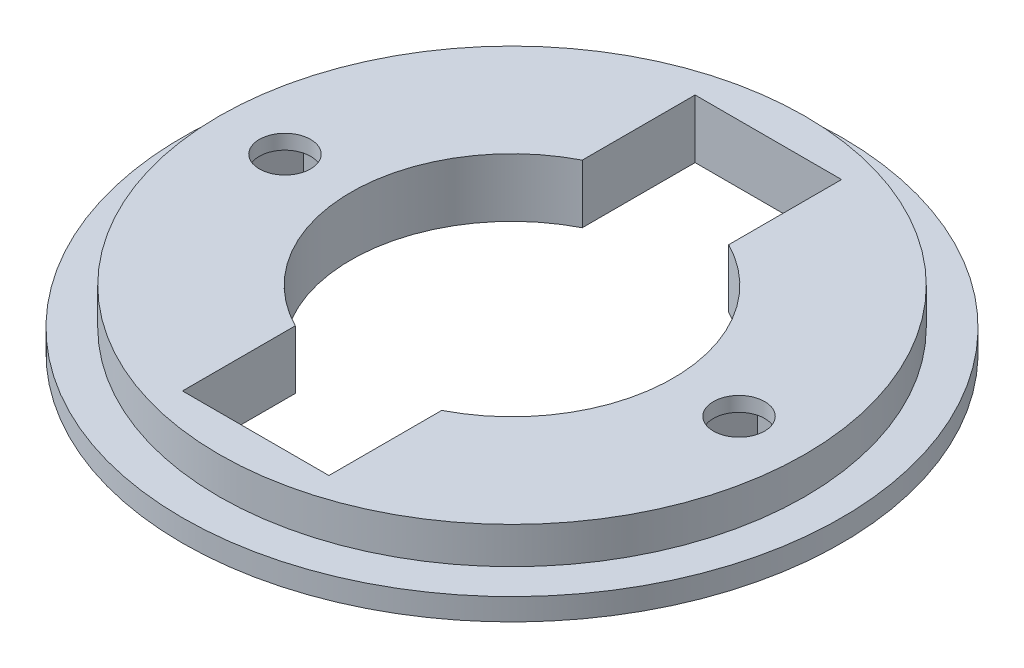
from build123d import *

# Parameters (mm, degrees)
SKETCH1_R           = 22.5
BOSS_EXTRUDE2_DEPTH = 4
CUT_EXTRUDE1_START  = -2.5
SKETCH2_R           = 22.5
SKETCH2_R_2         = 20
CUT_EXTRUDE1_DEPTH  = 2.5
CUT_EXTRUDE2_DEPTH  = 33.070235422
SKETCH4_R           = 1.75
CUT_EXTRUDE3_DEPTH  = 33.070235422
CUT_EXTRUDE4_DEPTH  = 3


with BuildPart() as part:
    # Sketch1 → Boss-Extrude2 (new body)
    with BuildSketch(Plane(origin=(0, 0, 0), x_dir=(1, 0, 0), z_dir=(0, 1, 0))):
        with Locations(Location((0, 0, 0), (0, 0, 270))):
            Circle(SKETCH1_R)
    extrude(amount=BOSS_EXTRUDE2_DEPTH)

    # Sketch2 → Cut-Extrude1 (cut)
    with BuildSketch(Plane(origin=(0, 4, 0), x_dir=(1, 0, 0), z_dir=(0, 1, 0)).offset(CUT_EXTRUDE1_START)):
        with Locations(Location((0, 0, 0), (0, 0, 270))):
            Circle(SKETCH2_R)
        with Locations(Location((0, 0, 0), (0, 0, 270))):
            Circle(SKETCH2_R_2, mode=Mode.SUBTRACT)
    extrude(amount=CUT_EXTRUDE1_DEPTH, mode=Mode.SUBTRACT)

    # Sketch3 → Cut-Extrude2 (cut, through all)
    with BuildSketch(Plane(origin=(0, 4, 0), x_dir=(1, 0, 0), z_dir=(0, 1, 0))):
        with BuildLine():
            Line((5, -9.797958971), (5, -17.5))
            Line((5, -17.5), (-5, -17.5))
            Line((-5, -17.5), (-5, -9.797958971))
            ThreePointArc((-5, -9.797958971), (-11, 0), (-5, 9.797958971))
            Line((-5, 9.797958971), (-5, 17.5))
            Line((-5, 17.5), (5, 17.5))
            Line((5, 17.5), (5, 9.797958971))
            ThreePointArc((5, 9.797958971), (11, 0), (5, -9.797958971))
        make_face()
    extrude(amount=-CUT_EXTRUDE2_DEPTH, mode=Mode.SUBTRACT)

    # Sketch4 → Cut-Extrude3 (cut, through all)
    with BuildSketch(Plane(origin=(0, 4, 0), x_dir=(1, 0, 0), z_dir=(0, 1, 0))):
        with Locations(Location((15.5, 0, 0), (0, 0, 270))):
            Circle(SKETCH4_R)
        with Locations(Location((-15.5, 0, 0), (0, 0, 90))):
            Circle(SKETCH4_R)
    extrude(amount=-CUT_EXTRUDE3_DEPTH, mode=Mode.SUBTRACT)

    # Sketch5 → Cut-Extrude4 (cut)
    with BuildSketch(Plane.XZ):
        Polygon((13.767949192, -3), (12.035898385, 0), (13.767949192, 3), (17.232050808, 3), (18.964101615, 0), (17.232050808, -3), align=None)
        Polygon((-12.035898385, 0), (-13.767949192, 3), (-17.232050808, 3), (-18.964101615, 0), (-17.232050808, -3), (-13.767949192, -3), align=None)
    extrude(amount=-CUT_EXTRUDE4_DEPTH, mode=Mode.SUBTRACT)


solid = part.part
